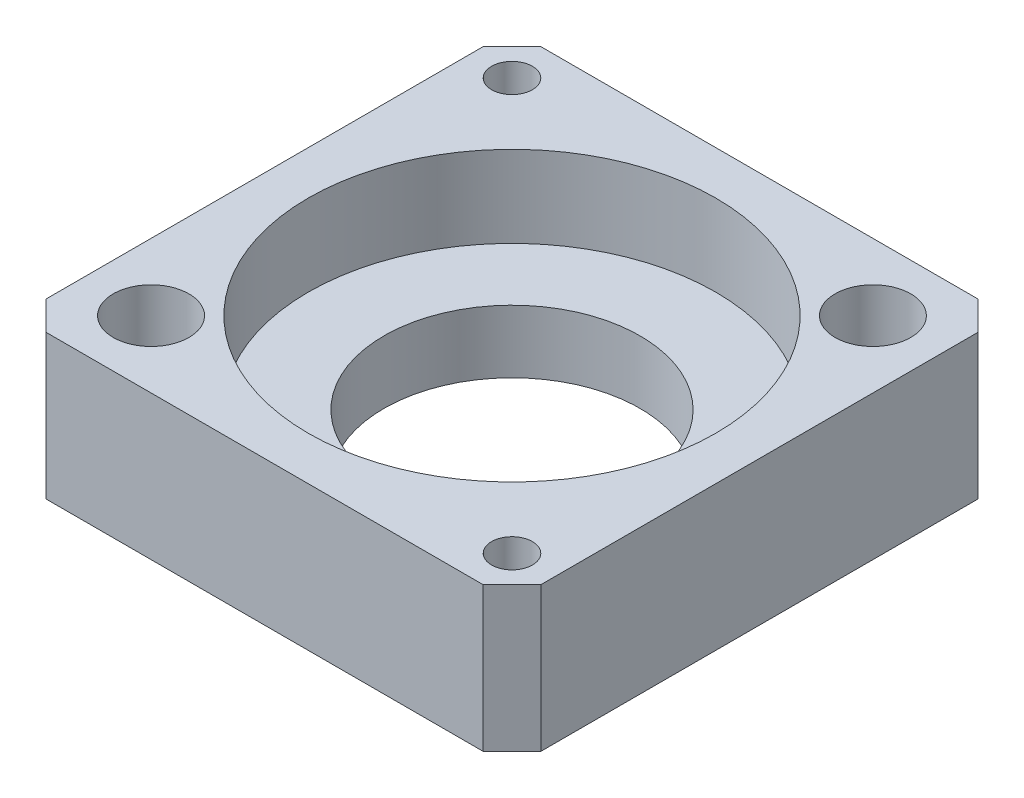
from build123d import *

# Parameters (mm, degrees)
EXTRUDE_1_DEPTH     = 12.4
SKETCH_2_R          = 17.5
CUT_EXTRUDE_1_DEPTH = 7
SKETCH_3_R          = 11
CUT_EXTRUDE_2_DEPTH = 61.510329697
SKETCH_4_R          = 3.25
CUT_EXTRUDE_3_DEPTH = 10
SKETCH_4_3_R        = 1.75
SKETCH_4_3_R_2      = 1.525
CUT_EXTRUDE_4_DEPTH = 62.36986231


with BuildPart() as part:
    # 草图1 → 凸台-拉伸1 (new body)
    with BuildSketch(Plane(origin=(0, 0, 0), x_dir=(1, 0, 0), z_dir=(0, 1, 0))):
        Polygon((0, 40.025126266), (0, 2.474873734), (2.474873734, 0), (40.025126266, 0), (42.5, 2.474873734), (42.5, 40.025126266), (40.025126266, 42.5), (2.474873734, 42.5), align=None)
    extrude(amount=EXTRUDE_1_DEPTH)

    # 草图2 → 切除-拉伸1 (cut)
    with BuildSketch(Plane(origin=(0, 12.4, 0), x_dir=(1, 0, 0), z_dir=(0, 1, 0))):
        with Locations((21.25, 21.25)):
            Circle(SKETCH_2_R)
    extrude(amount=-CUT_EXTRUDE_1_DEPTH, mode=Mode.SUBTRACT)

    # 草图3 → 切除-拉伸2 (cut, through all)
    with BuildSketch(Plane(origin=(0, 5.4, 0), x_dir=(1, 0, 0), z_dir=(0, 1, 0))):
        with Locations((21.25, 21.25)):
            Circle(SKETCH_3_R)
    extrude(amount=-CUT_EXTRUDE_2_DEPTH, mode=Mode.SUBTRACT)

    # 草图4 → 切除-拉伸3 (cut)
    with BuildSketch(Plane(origin=(0, 12.4, 0), x_dir=(1, 0, 0), z_dir=(0, 1, 0))):
        with Locations((36.75, 36.75)):
            Circle(SKETCH_4_R)
        with Locations((5.75, 5.75)):
            Circle(SKETCH_4_R)
    extrude(amount=-CUT_EXTRUDE_3_DEPTH, mode=Mode.SUBTRACT)

    # 草图4<3> → 切除-拉伸4 (cut, through all)
    with BuildSketch(Plane(origin=(0, 12.4, 0), x_dir=(1, 0, 0), z_dir=(0, 1, 0))):
        with Locations((3.57233047, 38.92766953)):
            Circle(SKETCH_4_3_R)
        with Locations((38.92766953, 3.57233047)):
            Circle(SKETCH_4_3_R)
        with Locations((5.75, 5.75)):
            Circle(SKETCH_4_3_R_2)
        with Locations((36.75, 36.75)):
            Circle(SKETCH_4_3_R_2)
    extrude(amount=-CUT_EXTRUDE_4_DEPTH, mode=Mode.SUBTRACT)


solid = part.part
